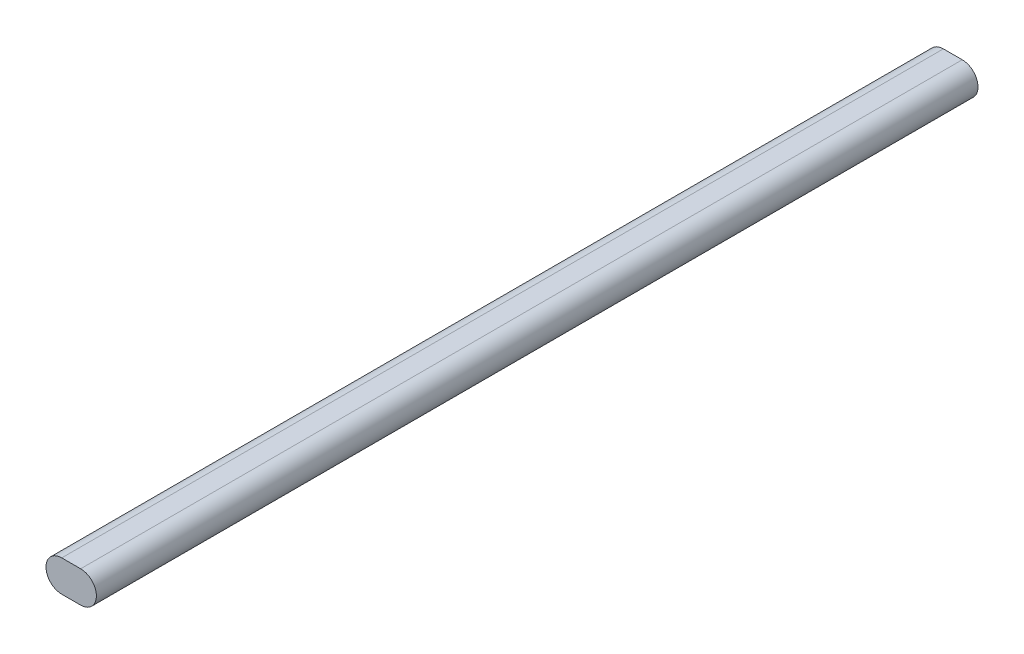
from build123d import *

# Parameters (mm, degrees)
SKETCH1_R           = 12.5
BOSS_EXTRUDE1_DEPTH = 700


with BuildPart() as part:
    # Sketch1 → Boss-Extrude1 (new body)
    with BuildSketch(Plane.XY):
        with Locations((7.5, 0)):
            Circle(SKETCH1_R)
        with Locations((-7.5, 0)):
            Circle(SKETCH1_R)
        with BuildLine():
            ThreePointArc((0, 10), (3.547152934, 11.858541229), (7.500000018, 12.5))
            Line((7.500000018, 12.5), (-7.500000011, 12.5))
            ThreePointArc((-7.500000011, 12.5), (-3.54715293, 11.858541227), (0, 10))
        make_face()
        with BuildLine():
            Line((-7.500000062, -12.5), (7.49999999, -12.5))
            ThreePointArc((7.49999999, -12.5), (3.54715292, -11.858541224), (0, -10))
            ThreePointArc((0, -10), (-3.547152954, -11.858541235), (-7.500000062, -12.5))
        make_face()
    extrude(amount=BOSS_EXTRUDE1_DEPTH)


solid = part.part
